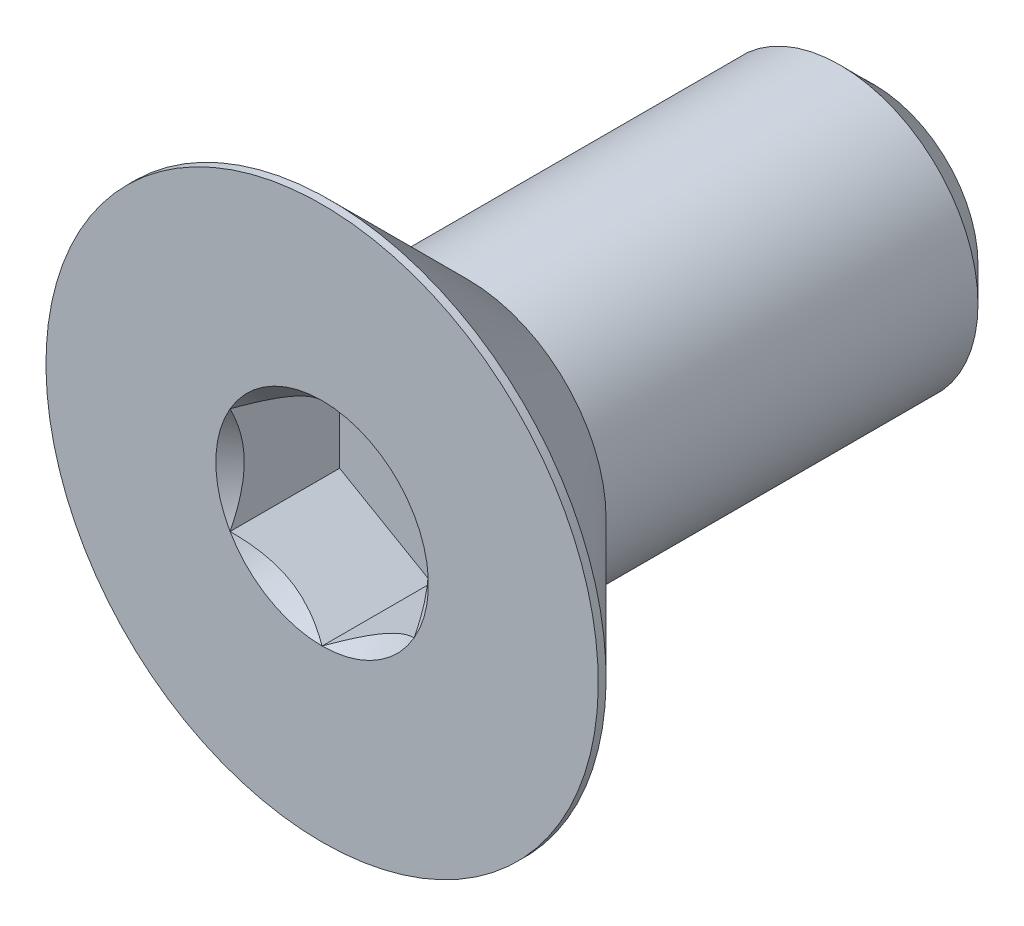
from build123d import *

# Parameters (mm, degrees)
CHAMFER1_SIZE      = 0.375
CUT_EXTRUDE2_DEPTH = 1.19


with BuildPart() as part:
    # Sketch1 → Revolve1 (revolve)
    with BuildSketch(Plane(origin=(0, 0, 0), x_dir=(0, 0, -1), z_dir=(1, 0, 0))):
        Polygon((-1.3, 1.5), (3, 1.5), (3, 0), (-1.81, 0), (-1.81, 1.5), align=None)
    revolve(axis=Axis((0, 0, 1.81), (0, 0, -1)))

    # Chamfer1
    chamfer1_edges = [part.edges().sort_by_distance(p)[0] for p in [
        (0, -1.5, -3),
    ]]
    chamfer(chamfer1_edges, length=CHAMFER1_SIZE)


with BuildPart() as body_2:
    # Sketch7 → Revolve2 (revolve)
    with BuildSketch(Plane(origin=(0, 0, 0), x_dir=(0, 0, -1), z_dir=(1, 0, 0))):
        Polygon((-2.915, 3), (-3, 3), (-3, 0), (-1.3, 0), (-1.3, 1.385), align=None)
    revolve(axis=Axis((0, 0, 3), (0, 0, -1)))

    # Sketch5 → Cut-Extrude2 (cut)
    with BuildSketch(Plane.XY.offset(3)):
        Polygon((1, -0.577350269), (1, 0.577350269), (0, 1.154700538), (-1, 0.577350269), (-1, -0.577350269), (0, -1.154700538), align=None)
    extrude(amount=-CUT_EXTRUDE2_DEPTH, mode=Mode.SUBTRACT)

    # Cut-Extrude3 cone 1 section (through the dimple's axis) → Cut-Extrude3 (revolve, cut)
    with BuildSketch(Plane(origin=(0, 0, 3), x_dir=(0, -1, 0), z_dir=(1, 0, 0))):
        Polygon((0, 0), (1.154700538, 0), (0, 1.154700538), align=None)
    revolve(axis=Axis((0, 0, 3), (0, 0, -1)), mode=Mode.SUBTRACT)

    # Combine1: union part
    add(part.part)


solid = body_2.part
